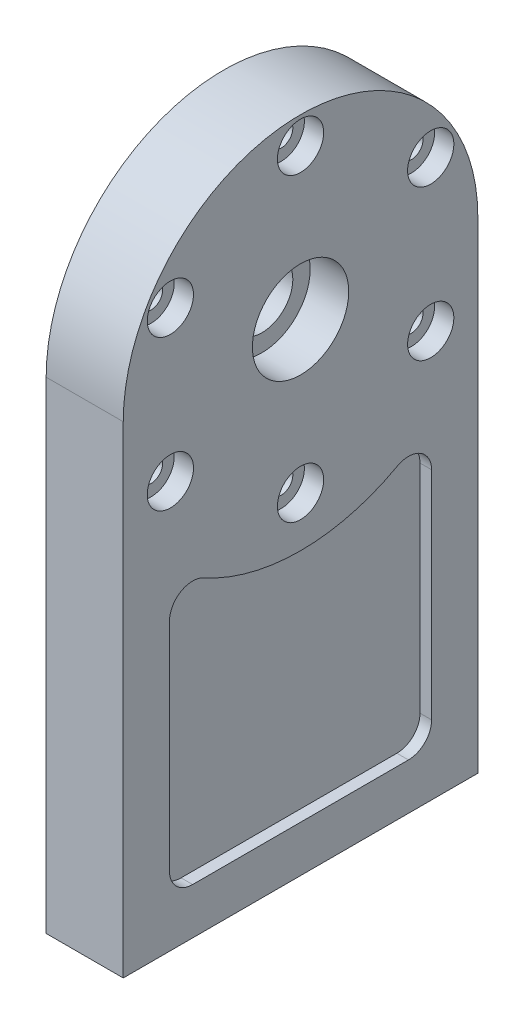
from build123d import *

# Parameters (mm, degrees)
BOSS_EXTRUDE1_DEPTH = 10
CUT_EXTRUDE1_DEPTH  = 3
SKETCH3_R           = 6
CUT_EXTRUDE2_DEPTH  = 5
SKETCH3_3_R         = 3
CUT_EXTRUDE3_DEPTH  = 179.204938203
CIRPATTERN1_COUNT   = 6
SKETCH4_R           = 12.5
CUT_EXTRUDE4_DEPTH  = 10
SKETCH4_3_R         = 8
CUT_EXTRUDE5_DEPTH  = 179.204938203
SKETCH5_R           = 5
CUT_EXTRUDE6_DEPTH  = 15


with BuildPart() as part:
    # Sketch1 → Boss-Extrude1 (new, symmetric)
    with BuildSketch(Plane(origin=(0, 0, 0), x_dir=(0, 0, -1), z_dir=(1, 0, 0))):
        with BuildLine():
            Line((46, 125), (46, 0))
            Line((46, 0), (-46, 0))
            Line((-46, 0), (-46, 125))
            ThreePointArc((-46, 125), (0, 171), (46, 125))
        make_face()
    extrude(amount=BOSS_EXTRUDE1_DEPTH, both=True)

    # Sketch2 → Cut-Extrude1 (cut)
    with BuildSketch(Plane(origin=(10, 0, 0), x_dir=(0, 0, -1), z_dir=(1, 0, 0))):
        with BuildLine():
            Line((-34, 74.206299603), (-34, 18))
            ThreePointArc((-34, 18), (-32.242640687, 13.757359313), (-28, 12))
            Line((-28, 12), (28, 12))
            ThreePointArc((28, 12), (32.242640687, 13.757359313), (34, 18))
            Line((34, 18), (34, 74.206299603))
            ThreePointArc((34, 74.206299603), (31.051285766, 79.372502771), (25.103448276, 79.460820334))
            ThreePointArc((25.103448276, 79.460820334), (0, 73), (-25.103448276, 79.460820334))
            ThreePointArc((-25.103448276, 79.460820334), (-31.051285766, 79.372502771), (-34, 74.206299603))
        make_face()
    cut_extrude1 = extrude(amount=-CUT_EXTRUDE1_DEPTH, mode=Mode.SUBTRACT)

    # Mirror1: Cut-Extrude1 across plane
    add(cut_extrude1.mirror(Plane(origin=(0, 0, 0), x_dir=(0, 0, 1), z_dir=(1, 0, 0))), mode=Mode.SUBTRACT)

    # Sketch3 → Cut-Extrude2 (cut)
    with BuildSketch(Plane(origin=(10, 0, 0), x_dir=(0, 0, -1), z_dir=(1, 0, 0))):
        with Locations((0, 164)):
            Circle(SKETCH3_R)
    cut_extrude2 = extrude(amount=-CUT_EXTRUDE2_DEPTH, mode=Mode.SUBTRACT)

    # Sketch3<3> → Cut-Extrude3 (cut, through all)
    with BuildSketch(Plane(origin=(10, 0, 0), x_dir=(0, 0, -1), z_dir=(1, 0, 0))):
        with Locations((0, 164)):
            Circle(SKETCH3_3_R)
    cut_extrude3 = extrude(amount=-CUT_EXTRUDE3_DEPTH, mode=Mode.SUBTRACT)

    # CirPattern1: Cut-Extrude2, Cut-Extrude3 ×6 about axis
    cirpattern1_axis = Axis((10, 125, 0), (1, 0, 0))
    add([cut_extrude2.rotate(cirpattern1_axis, i * 360 / CIRPATTERN1_COUNT) for i in range(1, CIRPATTERN1_COUNT)], mode=Mode.SUBTRACT)
    add([cut_extrude3.rotate(cirpattern1_axis, i * 360 / CIRPATTERN1_COUNT) for i in range(1, CIRPATTERN1_COUNT)], mode=Mode.SUBTRACT)

    # Sketch4 → Cut-Extrude4 (cut)
    with BuildSketch(Plane(origin=(10, 0, 0), x_dir=(0, 0, -1), z_dir=(1, 0, 0))):
        with Locations((0, 125)):
            Circle(SKETCH4_R)
    extrude(amount=-CUT_EXTRUDE4_DEPTH, mode=Mode.SUBTRACT)

    # Sketch4<3> → Cut-Extrude5 (cut, through all)
    with BuildSketch(Plane(origin=(10, 0, 0), x_dir=(0, 0, -1), z_dir=(1, 0, 0))):
        with Locations((0, 125)):
            Circle(SKETCH4_3_R)
    extrude(amount=-CUT_EXTRUDE5_DEPTH, mode=Mode.SUBTRACT)

    # Sketch5 → Cut-Extrude6 (cut)
    with BuildSketch(Plane.XZ):
        with Locations((0, 30)):
            Circle(SKETCH5_R)
        with Locations((0, -30)):
            Circle(SKETCH5_R)
    extrude(amount=-CUT_EXTRUDE6_DEPTH, mode=Mode.SUBTRACT)


solid = part.part
